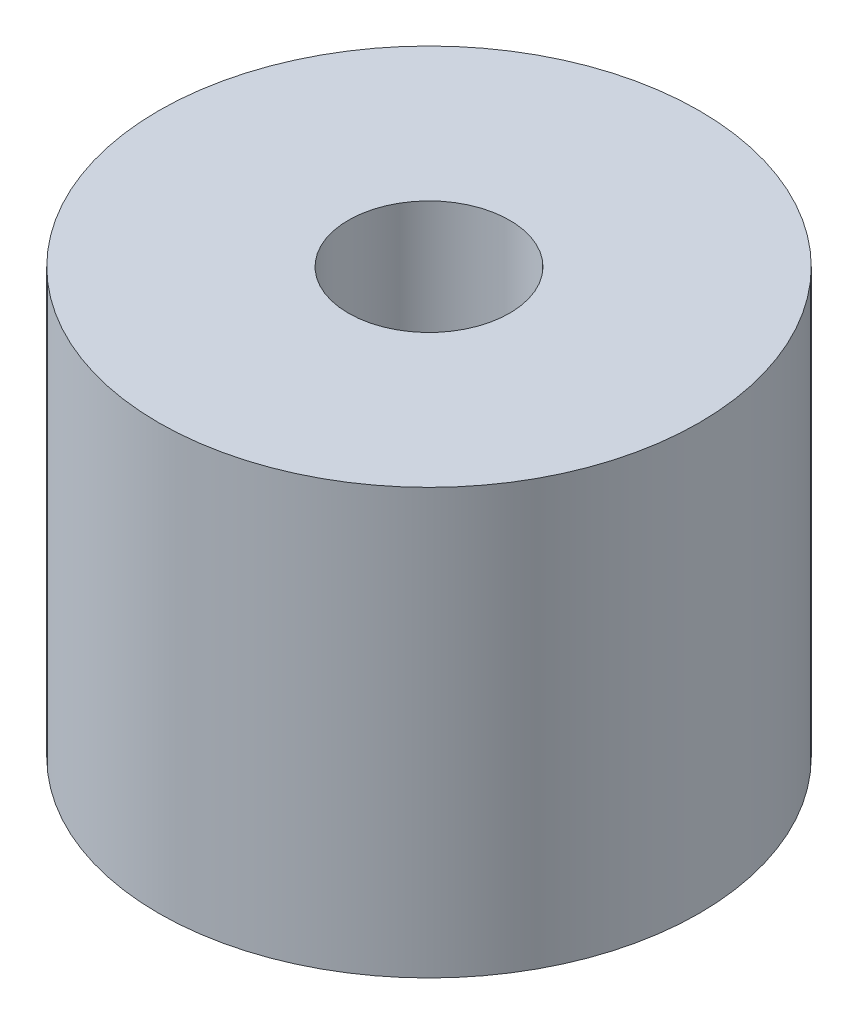
from build123d import *

# Parameters (mm, degrees)
SKETCH1_R           = 14.25
SKETCH1_R_2         = 4.25
BOSS_EXTRUDE2_DEPTH = 22.4


with BuildPart() as part:
    # Sketch1 → Boss-Extrude2 (new body)
    with BuildSketch(Plane(origin=(0, 0, 0), x_dir=(1, 0, 0), z_dir=(0, 1, 0))):
        with Locations(Location((0, 0, 0), (0, 0, 270))):
            Circle(SKETCH1_R)
        with Locations(Location((0, 0, 0), (0, 0, 270))):
            Circle(SKETCH1_R_2, mode=Mode.SUBTRACT)
    extrude(amount=BOSS_EXTRUDE2_DEPTH)


solid = part.part
